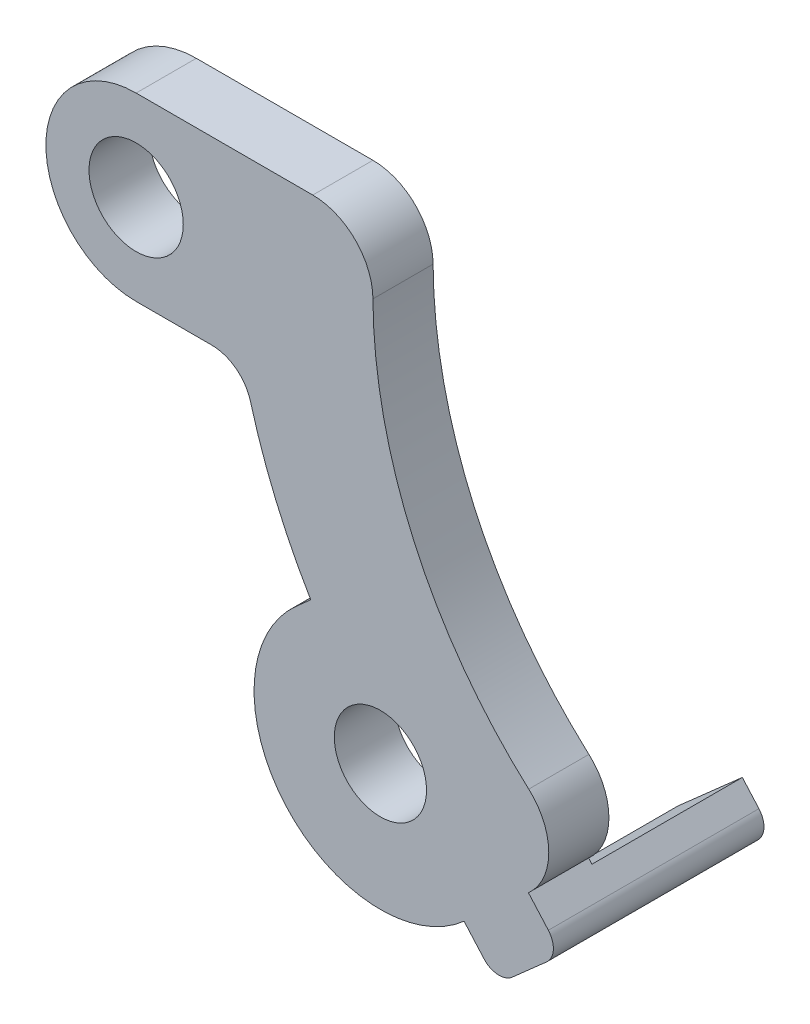
from build123d import *

# Parameters (mm, degrees)
SKETCH1_R           = 2.35
SKETCH1_R_2         = 2.3
BOSS_EXTRUDE2_DEPTH = 3
SKETCH2_W           = 4.283202477
SKETCH2_H           = 3
BOSS_EXTRUDE3_DEPTH = 2.5
BOSS_EXTRUDE4_DEPTH = 10.5
FILLET1_R           = 1
SKETCH4_W           = 4.283202477
SKETCH4_H           = 7.5
CUT_EXTRUDE1_DEPTH  = 0.25


with BuildPart() as part:
    # Sketch1 → Boss-Extrude2 (new body)
    with BuildSketch(Plane.XY.offset(-130.24387898)):
        with BuildLine():
            Line((-15.010059364, 38.189351968), (-15.708117617, 37.572463316))
            ThreePointArc((-15.708117617, 37.572463316), (-16.257044738, 28.67984396), (-7.364425381, 28.130916839))
            Line((-7.364425381, 28.130916839), (-4.154897186, 30.967244081))
            ThreePointArc((-4.154897186, 30.967244081), (-3.141509811, 33.204488286), (-4.138848078, 35.44893298))
            ThreePointArc((-4.138848078, 35.44893298), (-9.854378586, 43.268649811), (-11.908958835, 52.734058429))
            ThreePointArc((-11.908958835, 52.734058429), (-12.792945326, 54.845611755), (-14.908920841, 55.718960016))
            Line((-14.908920841, 55.718960016), (-23.716053845, 55.718960016))
            ThreePointArc((-23.716053845, 55.718960016), (-28.216053845, 51.218960016), (-23.716053845, 46.718960016))
            Line((-23.716053845, 46.718960016), (-19.942226175, 46.718960016))
            ThreePointArc((-19.942226175, 46.718960016), (-18.729620599, 46.309427783), (-18.013616093, 45.248547734))
            ThreePointArc((-18.013616093, 45.248547734), (-16.74918621, 41.617962479), (-15.010059364, 38.189351968))
        make_face()
        with Locations((-23.716053845, 51.218960016)):
            Circle(SKETCH1_R, mode=Mode.SUBTRACT)
        with Locations((-11.536271499, 32.851690078)):
            Circle(SKETCH1_R_2, mode=Mode.SUBTRACT)
    extrude(amount=BOSS_EXTRUDE2_DEPTH)

    # Sketch2 → Boss-Extrude3 (add)
    with BuildSketch(Plane(origin=(-17.188019546, 19.449601065, 0), x_dir=(0.7493290854811405, 0.6621977964717171, 0), z_dir=(0.6621977964717171, -0.7493290854811405, 0))):
        with Locations((15.251454246, -128.74387898)):
            Rectangle(SKETCH2_W, SKETCH2_H)
    extrude(amount=BOSS_EXTRUDE3_DEPTH)

    # Sketch3 → Boss-Extrude4 (add)
    with BuildSketch(Plane.XY.offset(-127.24387898)):
        Polygon((-7.364425381, 28.130916839), (-4.154897186, 30.967244081), (-2.499402695, 29.093921367), (-5.70893089, 26.257594125), align=None)
    extrude(amount=-BOSS_EXTRUDE4_DEPTH)

    # Fillet1
    fillet1_edges = [part.edges().sort_by_distance(p)[0] for p in [
        (-5.70893089, 26.257594125, -132.49387898),
        (-2.499402695, 29.093921367, -132.49387898),
    ]]
    fillet(fillet1_edges, radius=FILLET1_R)

    # Sketch4 → Cut-Extrude1 (cut)
    with BuildSketch(Plane(origin=(-17.188019546, 19.449601065, 0), x_dir=(0.7493290854811406, 0.6621977964717171, 0), z_dir=(-0.6621977964717171, 0.7493290854811406, 0))):
        with Locations((15.251454246, 133.99387898)):
            Rectangle(SKETCH4_W, SKETCH4_H)
    extrude(amount=-CUT_EXTRUDE1_DEPTH, mode=Mode.SUBTRACT)


solid = part.part
